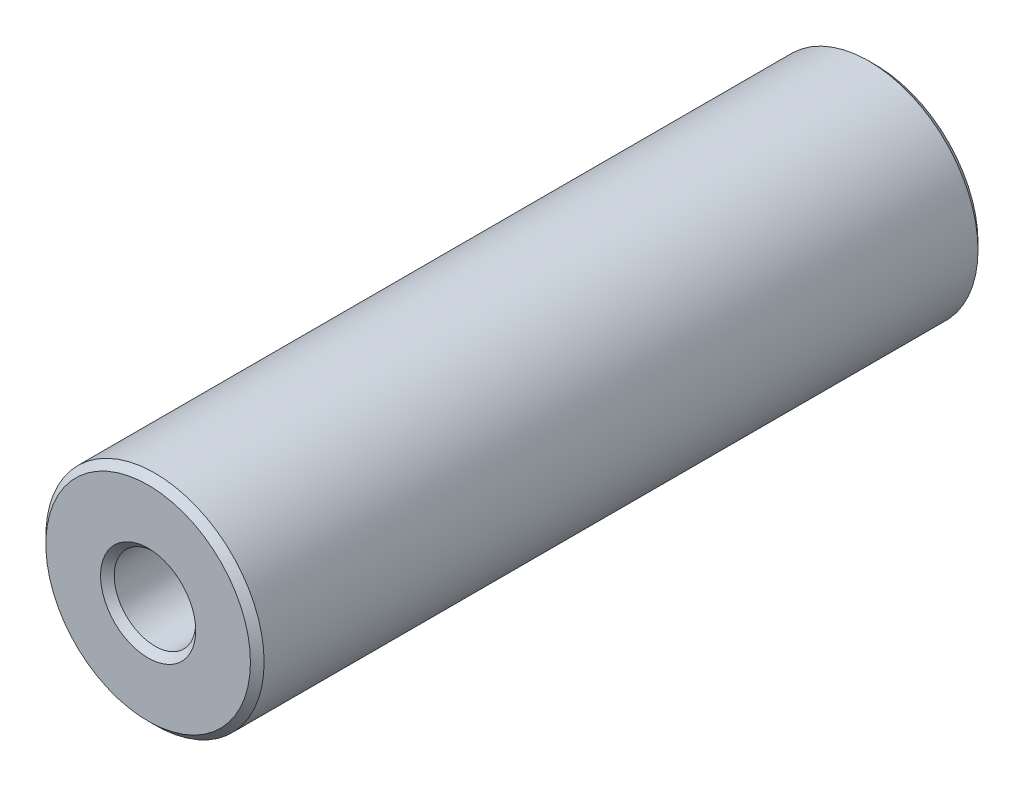
from build123d import *

# Parameters (mm, degrees)
BOSS_EXTRUDE1_DEPTH      = 15.875
BOSS_EXTRUDE1_DEPTH_BACK = 15.875
SKETCH3_R                = 4.7625
SKETCH3_R_2              = 1.778
CHAMFER1_SIZE            = 0.29845


with BuildPart() as part:
    # Sketch3 → Boss-Extrude1 (new, two sides: drawn at the far end of the back side and taken through both)
    with BuildSketch(Plane.XY.offset(-BOSS_EXTRUDE1_DEPTH_BACK)):
        Circle(SKETCH3_R)
        Circle(SKETCH3_R_2, mode=Mode.SUBTRACT)
    extrude(amount=BOSS_EXTRUDE1_DEPTH + BOSS_EXTRUDE1_DEPTH_BACK)

    # Chamfer1
    chamfer1_edges = [part.edges().sort_by_distance(p)[0] for p in [
        (-4.7625, 0, -15.875),
        (-1.778, 0, -15.875),
        (-4.7625, 0, 15.875),
        (-1.778, 0, 15.875),
    ]]
    chamfer(chamfer1_edges, length=CHAMFER1_SIZE)


solid = part.part
